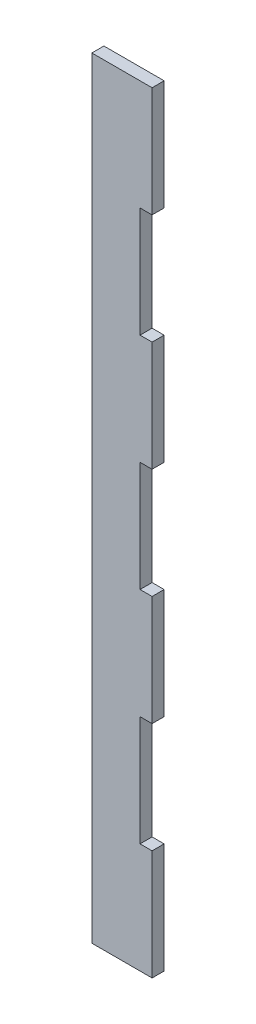
from build123d import *

# Parameters (mm, degrees)
SKETCH1_W           = 6.35
SKETCH1_H           = 203.2
SKETCH1_W_2         = 3.175
SKETCH1_H_2         = 29.028571429
BOSS_EXTRUDE1_DEPTH = 3.175


with BuildPart() as part:
    # Sketch1 → Boss-Extrude1 (new body)
    with BuildSketch(Plane.XY):
        with Locations((-3.175, 0)):
            Rectangle(SKETCH1_W, SKETCH1_H)
        Polygon((6.35, 101.6), (0, 101.6), (0, -101.6), (6.35, -101.6), (6.35, -72.571428571), (6.35, -43.542857143), (6.35, -14.514285714), (6.35, 14.514285714), (6.35, 43.542857143), (6.35, 72.571428571), align=None)
        with Locations((7.9375, 87.085714286)):
            Rectangle(SKETCH1_W_2, SKETCH1_H_2)
        with Locations((7.9375, 29.028571429)):
            Rectangle(SKETCH1_W_2, SKETCH1_H_2)
        with Locations((7.9375, -29.028571429)):
            Rectangle(SKETCH1_W_2, SKETCH1_H_2)
        with Locations((7.9375, -87.085714286)):
            Rectangle(SKETCH1_W_2, SKETCH1_H_2)
    extrude(amount=BOSS_EXTRUDE1_DEPTH)


solid = part.part
